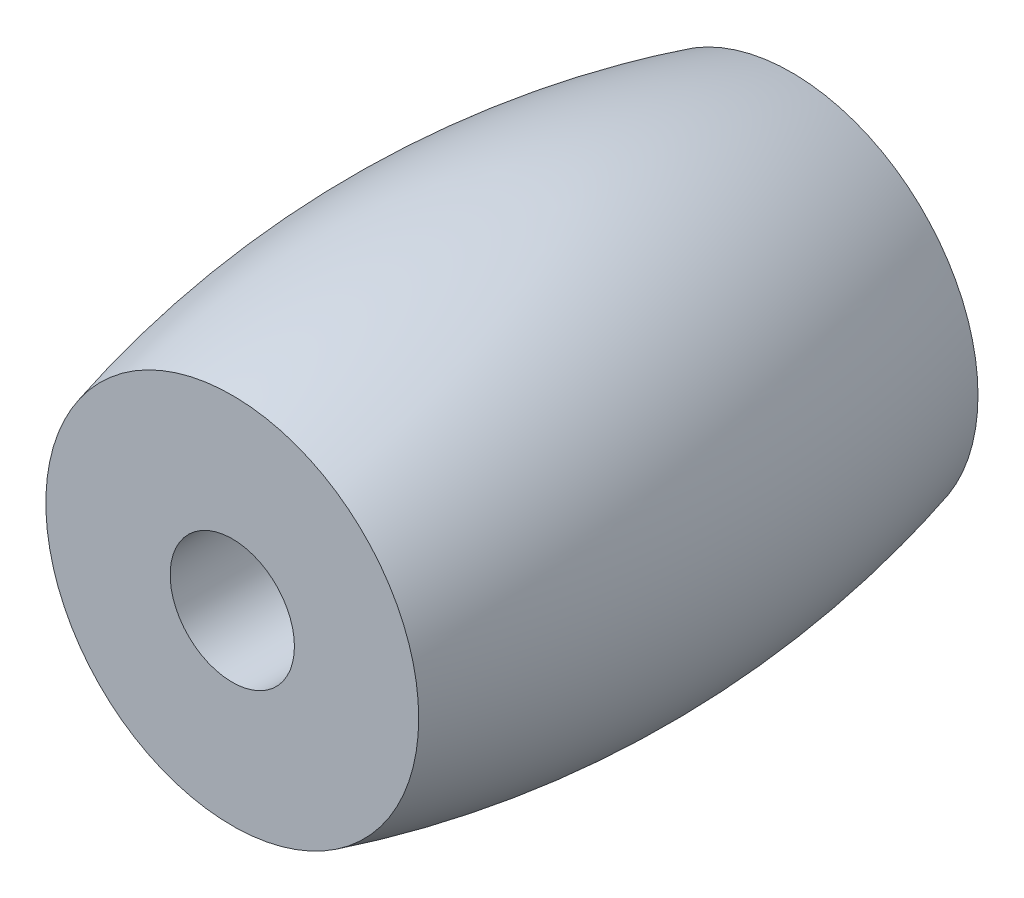
from build123d import *


with BuildPart() as part:
    # 草图1 → 旋转1 (revolve)
    with BuildSketch(Plane(origin=(0, 0, 0), x_dir=(1, 0, 0), z_dir=(0, 1, 0))):
        with BuildLine():
            Line((4.5, 6.75), (1.5, 6.75))
            Line((1.5, 6.75), (1.5, -6.75))
            Line((1.5, -6.75), (4.5, -6.75))
            ThreePointArc((4.5, -6.75), (5.4, 0), (4.5, 6.75))
        make_face()
    revolve(axis=Axis((0, 0, -6.75), (0, 0, 1)))


solid = part.part
